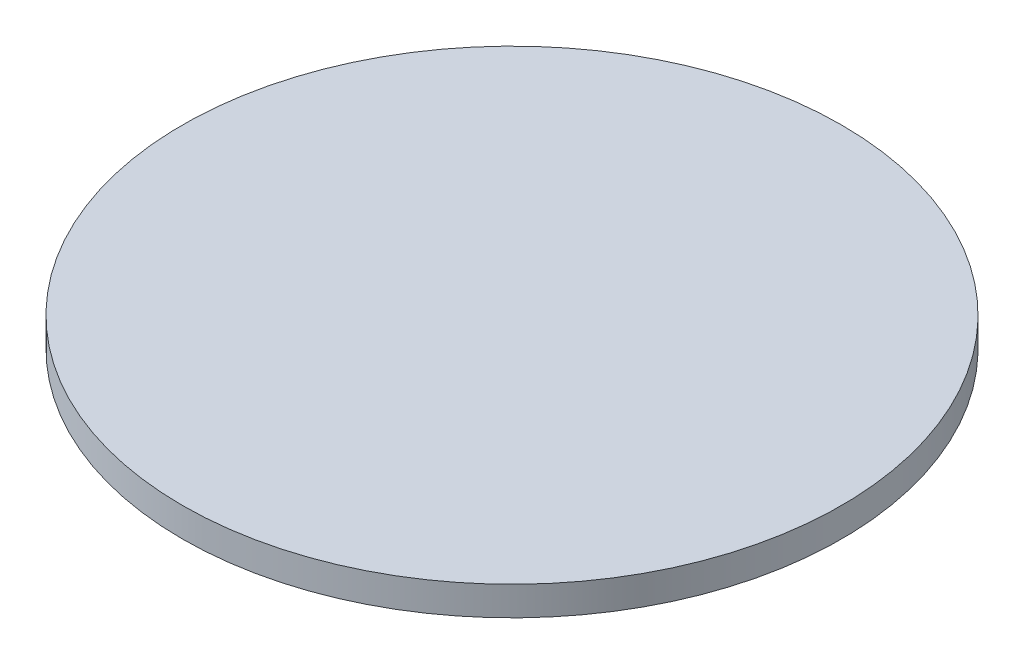
from build123d import *

# Parameters (mm, degrees)
SKETCH1_R           = 6.35
BOSS_EXTRUDE1_DEPTH = 0.560547


with BuildPart() as part:
    # Sketch1 → Boss-Extrude1 (new body)
    with BuildSketch(Plane(origin=(0, 0, 0), x_dir=(1, 0, 0), z_dir=(0, 1, 0))):
        with Locations(Location((0, 0, 0), (0, 0, 270))):
            Circle(SKETCH1_R)
    extrude(amount=BOSS_EXTRUDE1_DEPTH)


solid = part.part
